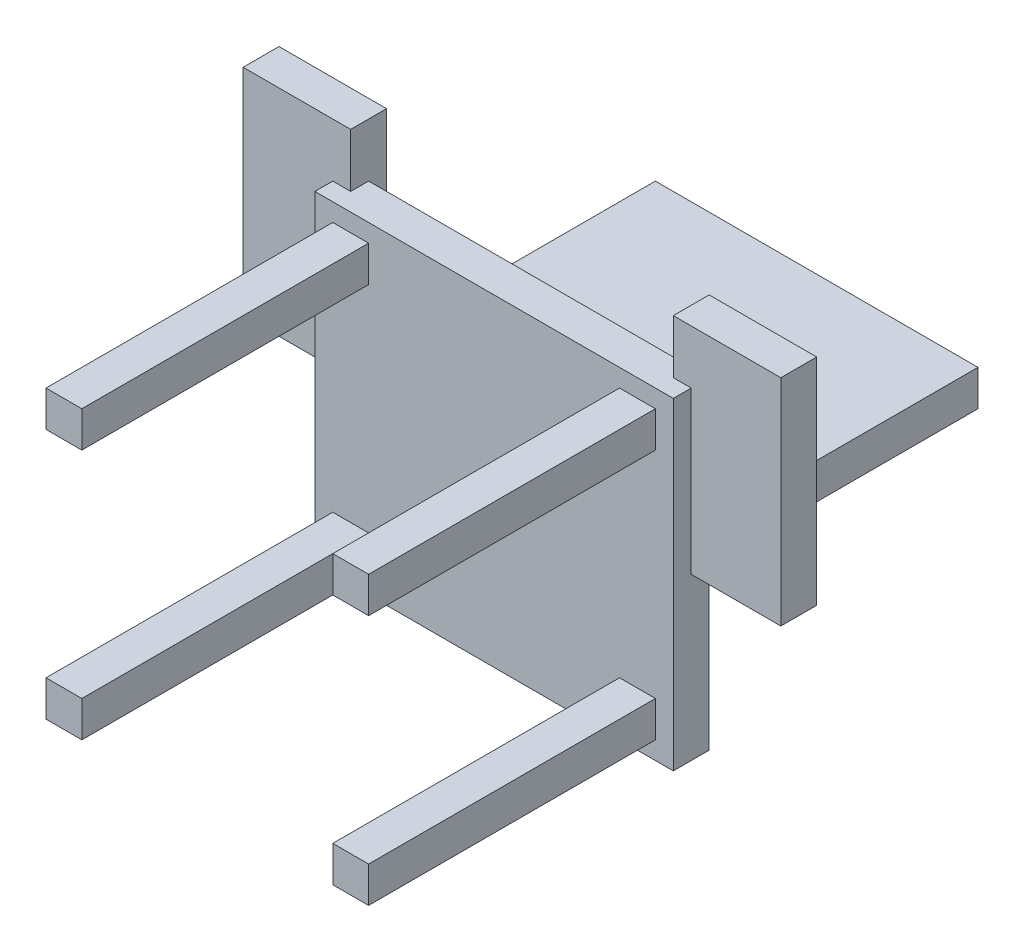
from build123d import *

# Parameters (mm, degrees)
SKETCH_1_W      = 500
SKETCH_1_H      = 450
EXTRUDE_1_DEPTH = 50
SKETCH_2_W      = 50
SKETCH_2_H      = 50
EXTRUDE_2_DEPTH = 450
SKETCH_3_W      = 50
SKETCH_3_H      = 50
EXTRUDE_3_DEPTH = 450
SKETCH_4_W      = 50
SKETCH_4_H      = 50
EXTRUDE_4_DEPTH = 450
SKETCH_5_W      = 50
SKETCH_5_H      = 50
EXTRUDE_5_DEPTH = 450
SKETCH_6_W      = 450
SKETCH_6_H      = 50
EXTRUDE_6_DEPTH = 400
SKETCH_7_W      = 50
SKETCH_7_H      = 300
EXTRUDE_7_DEPTH = 150
SKETCH_8_W      = 50
SKETCH_8_H      = 300
EXTRUDE_8_DEPTH = 150


with BuildPart() as part:
    # 草图1 → 凸台-拉伸1 (new body)
    with BuildSketch(Plane.XY):
        Rectangle(SKETCH_1_W, SKETCH_1_H)
    extrude(amount=EXTRUDE_1_DEPTH)

    # 草图2 → 凸台-拉伸2 (add)
    with BuildSketch(Plane.XY):
        with Locations((-200, -175)):
            Rectangle(SKETCH_2_W, SKETCH_2_H)
    extrude(amount=EXTRUDE_2_DEPTH)

    # 草图3 → 凸台-拉伸3 (add)
    with BuildSketch(Plane.XY):
        with Locations((200, -175)):
            Rectangle(SKETCH_3_W, SKETCH_3_H)
    extrude(amount=EXTRUDE_3_DEPTH)

    # 草图4 → 凸台-拉伸4 (add)
    with BuildSketch(Plane.XY):
        with Locations((-200, 175)):
            Rectangle(SKETCH_4_W, SKETCH_4_H)
    extrude(amount=EXTRUDE_4_DEPTH)

    # 草图5 → 凸台-拉伸5 (add)
    with BuildSketch(Plane.XY):
        with Locations((200, 175)):
            Rectangle(SKETCH_5_W, SKETCH_5_H)
    extrude(amount=EXTRUDE_5_DEPTH)

    # 草图6 → 凸台-拉伸6 (add)
    with BuildSketch(Plane(origin=(0, 0, 0), x_dir=(-1, 0, 0), z_dir=(0, 0, -1))):
        Rectangle(SKETCH_6_W, SKETCH_6_H)
    extrude(amount=EXTRUDE_6_DEPTH)

    # 草图7 → 凸台-拉伸7 (add)
    with BuildSketch(Plane.ZY.offset(225)):
        with Locations((0, 150)):
            Rectangle(SKETCH_7_W, SKETCH_7_H)
    extrude(amount=EXTRUDE_7_DEPTH)

    # 草图8 → 凸台-拉伸8 (add)
    with BuildSketch(Plane(origin=(225, 0, 0), x_dir=(0, 0, -1), z_dir=(1, 0, 0))):
        with Locations((0, 150)):
            Rectangle(SKETCH_8_W, SKETCH_8_H)
    extrude(amount=EXTRUDE_8_DEPTH)


solid = part.part
